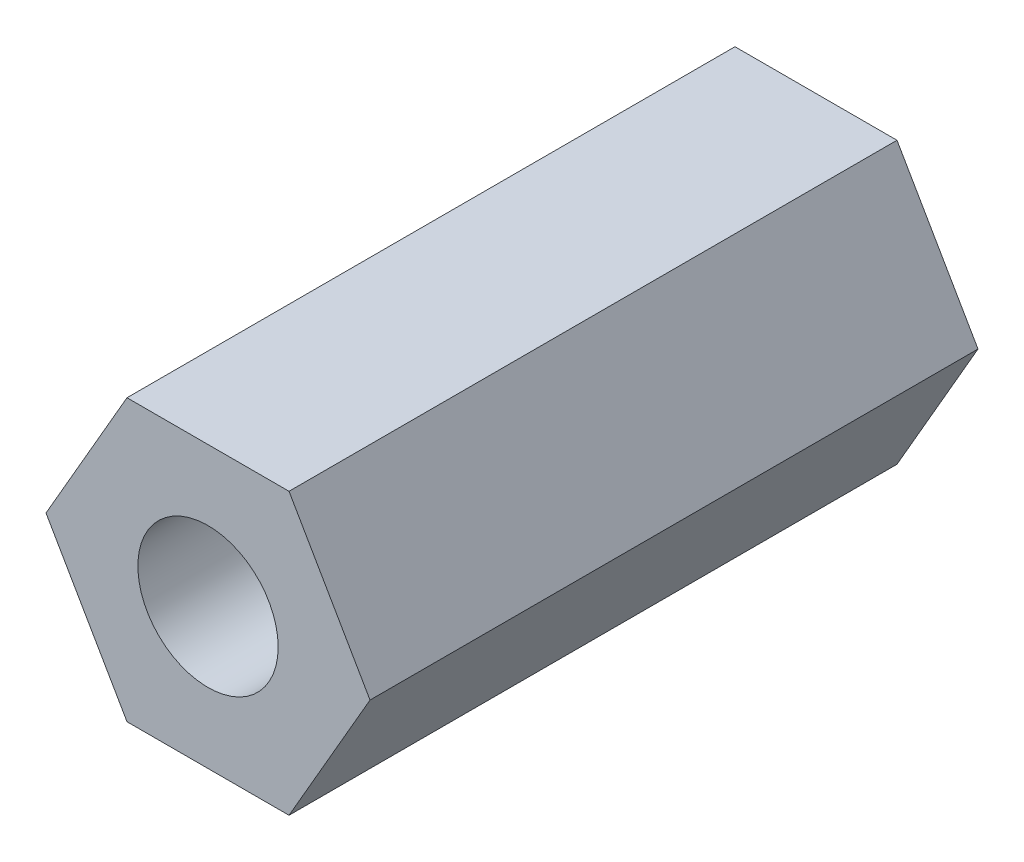
from build123d import *

# Parameters (mm, degrees)
EXTRUDE_1_DEPTH     = 13
SKETCH_2_R          = 1.5
CUT_EXTRUDE_1_DEPTH = 16.231546212


with BuildPart() as part:
    # 草图1 → 凸台-拉伸1 (new body)
    with BuildSketch(Plane.XY):
        Polygon((0, 0), (3.464101615, 0), (5.196152423, -3), (3.464101615, -6), (0, -6), (-1.732050808, -3), align=None)
    extrude(amount=EXTRUDE_1_DEPTH)

    # 草图2 → 切除-拉伸1 (cut, through all)
    with BuildSketch(Plane.XY.offset(13)):
        with Locations((1.732050808, -3)):
            Circle(SKETCH_2_R)
    extrude(amount=-CUT_EXTRUDE_1_DEPTH, mode=Mode.SUBTRACT)


solid = part.part
